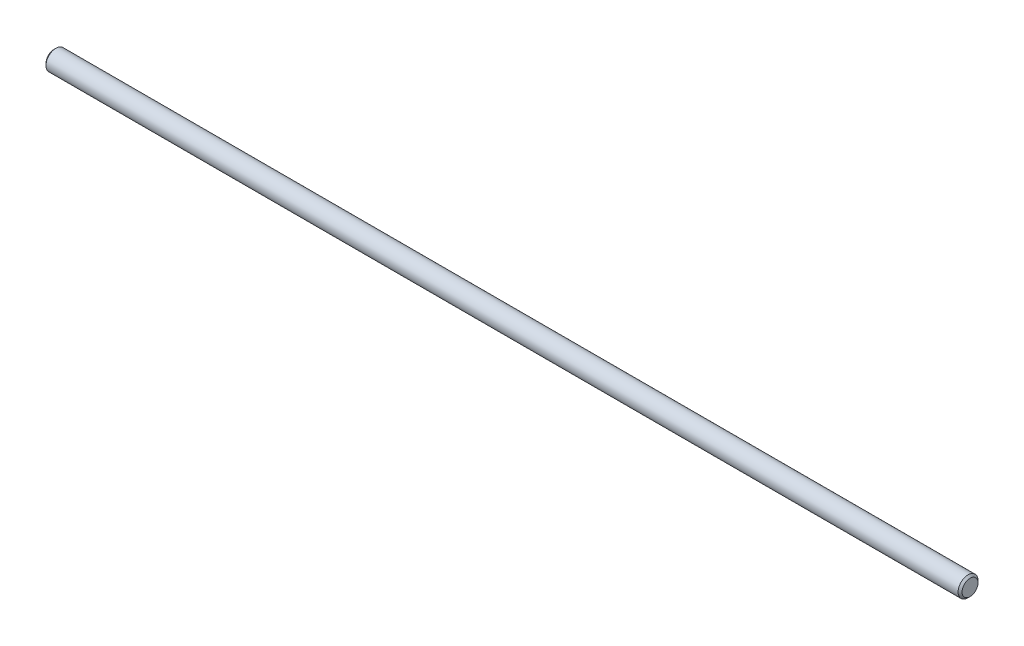
from build123d import *

# Parameters (mm, degrees)
SKETCH1_R           = 5
BOSS_EXTRUDE1_DEPTH = 230
CHAMFER1_SIZE       = 1


with BuildPart() as part:
    # Sketch1 → Boss-Extrude1 (new, symmetric)
    with BuildSketch(Plane(origin=(0, 0, 0), x_dir=(0, 0, -1), z_dir=(1, 0, 0))):
        Circle(SKETCH1_R)
    extrude(amount=BOSS_EXTRUDE1_DEPTH, both=True)

    # Chamfer1
    chamfer1_edges = [part.edges().sort_by_distance(p)[0] for p in [
        (-230, 0, 5),
        (230, 0, 5),
    ]]
    chamfer(chamfer1_edges, length=CHAMFER1_SIZE)


solid = part.part
